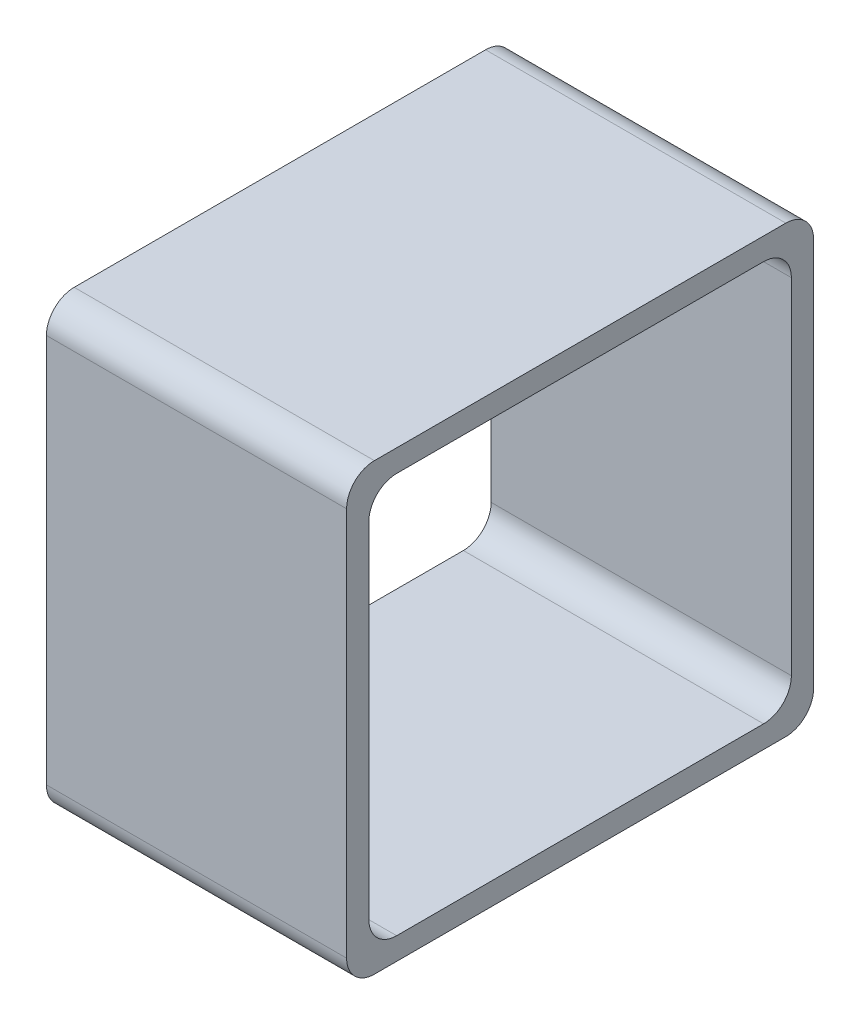
from build123d import *

# Parameters (mm, degrees)
SKETCH_1_W      = 42
SKETCH_1_H      = 40
SKETCH_1_W_2    = 38
SKETCH_1_H_2    = 36
EXTRUDE_1_DEPTH = 27
FILLET_1_R      = 2.5


with BuildPart() as part:
    # 草图1 → 凸台-拉伸1 (new body)
    with BuildSketch(Plane(origin=(0, 0, 0), x_dir=(0, 0, -1), z_dir=(1, 0, 0))):
        Rectangle(SKETCH_1_W, SKETCH_1_H)
        Rectangle(SKETCH_1_W_2, SKETCH_1_H_2, mode=Mode.SUBTRACT)
    extrude(amount=EXTRUDE_1_DEPTH)

    # 圆角1
    fillet_1_edges = [part.edges().sort_by_distance(p)[0] for p in [
        (13.5, -18, -19),
        (13.5, 18, -19),
        (13.5, 18, 19),
        (13.5, -18, 19),
        (13.5, 20, 21),
        (13.5, 20, -21),
        (13.5, -20, -21),
        (13.5, -20, 21),
    ]]
    fillet(fillet_1_edges, radius=FILLET_1_R)


solid = part.part
